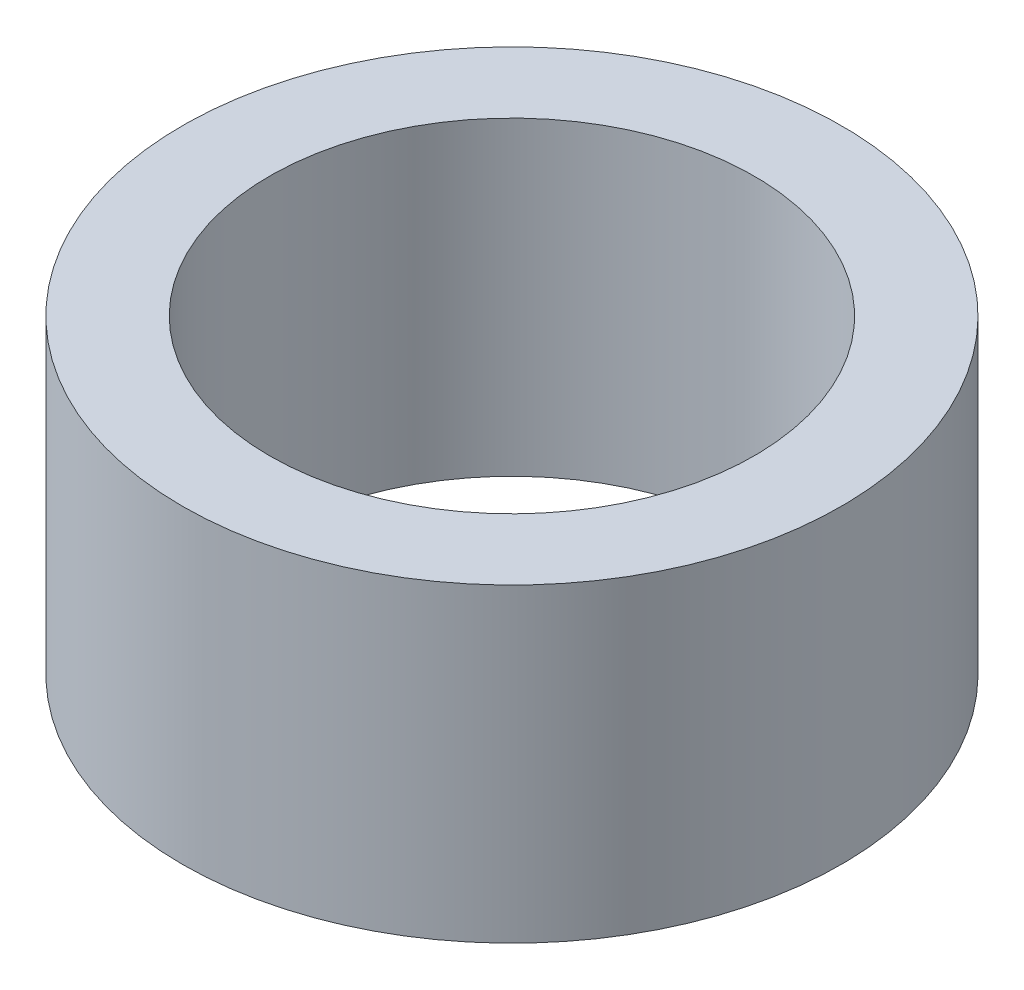
from build123d import *

# Parameters (mm, degrees)
SKETCH1_R           = 4.25
SKETCH1_R_2         = 3.125
BOSS_EXTRUDE1_DEPTH = 4


with BuildPart() as part:
    # Sketch1 → Boss-Extrude1 (new body)
    with BuildSketch(Plane(origin=(0, 0, 0), x_dir=(1, 0, 0), z_dir=(0, 1, 0))):
        with Locations(Location((0, 0, 0), (0, 0, 270))):
            Circle(SKETCH1_R)
        with Locations(Location((0, 0, 0), (0, 0, 270))):
            Circle(SKETCH1_R_2, mode=Mode.SUBTRACT)
    extrude(amount=BOSS_EXTRUDE1_DEPTH)


solid = part.part
